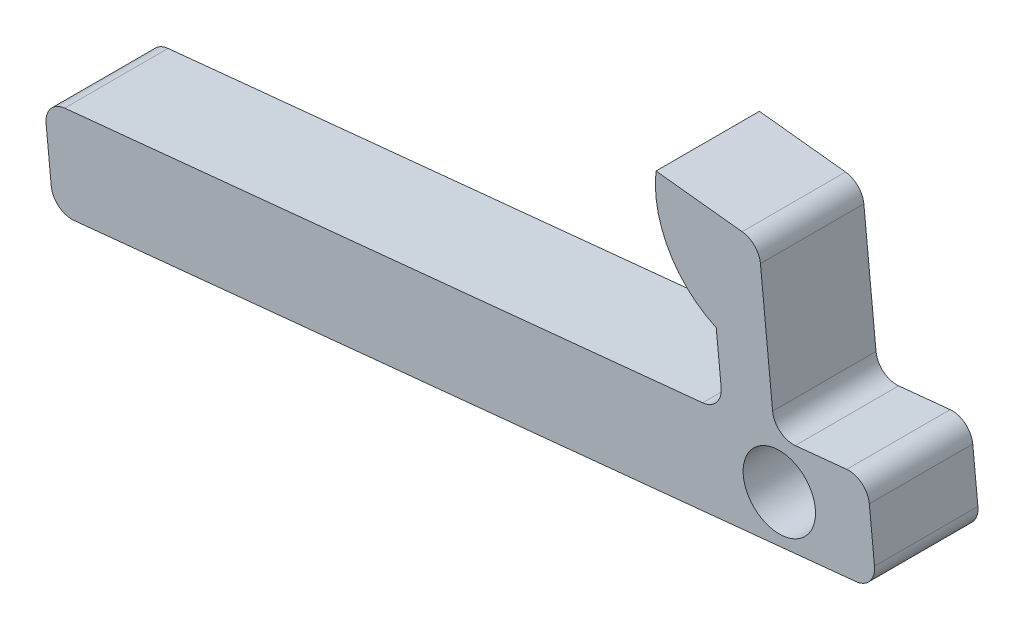
from build123d import *

# Parameters (mm, degrees)
SKETCH1_R           = 3.5
BOSS_EXTRUDE1_DEPTH = 10
FILLET1_R           = 2
SKETCH4_R           = 4.5
CUT_EXTRUDE1_DEPTH  = 26
FILLET2_R           = 2


with BuildPart() as part:
    # Sketch1 → Boss-Extrude1 (new body)
    with BuildSketch(Plane.XY):
        with BuildLine():
            Line((57.741071939, 36.562090071), (56.204690111, 51.925908355))
            Line((56.204690111, 51.925908355), (46.264731801, 53.020087861))
            ThreePointArc((46.264731801, 53.020087861), (47.519621722, 46.969136515), (52.091231644, 42.811114916))
            Line((52.091231644, 42.811114916), (52.765885988, 36.064571476))
            Line((52.765885988, 36.064571476), (-12.906568566, 29.49732602))
            Line((-12.906568566, 29.49732602), (-12.011035094, 20.541991308))
            Line((-12.011035094, 20.541991308), (58.63660541, 27.606755359))
            Line((58.63660541, 27.606755359), (67.591940122, 28.50228883))
            Line((67.591940122, 28.50228883), (66.696406651, 37.457623542))
            Line((66.696406651, 37.457623542), (57.741071939, 36.562090071))
        make_face()
        with Locations((58.188838675, 32.084422715)):
            Circle(SKETCH1_R, mode=Mode.SUBTRACT)
    extrude(amount=BOSS_EXTRUDE1_DEPTH)

    # Fillet1
    fillet1_edges = [part.edges().sort_by_distance(p)[0] for p in [
        (56.204690111, 51.925908355, 5),
        (57.741071939, 36.562090071, 5),
        (66.696406651, 37.457623542, 5),
        (67.591940122, 28.50228883, 5),
        (52.765885988, 36.064571476, 5),
    ]]
    fillet(fillet1_edges, radius=FILLET1_R)

    # Sketch4 → Cut-Extrude1 (cut)
    with BuildSketch(Plane(origin=(0, 0, 0), x_dir=(1, 0, 0), z_dir=(0, 1, 0))):
        with Locations(Location((4.295066604, -5, 0), (0, 0, 180))):
            Circle(SKETCH4_R)
    extrude(amount=CUT_EXTRUDE1_DEPTH, mode=Mode.SUBTRACT)

    # Fillet2
    fillet2_edges = [part.edges().sort_by_distance(p)[0] for p in [
        (-12.011035094, 20.541991308, 5),
        (-12.906568566, 29.49732602, 5),
    ]]
    fillet(fillet2_edges, radius=FILLET2_R)


solid = part.part
